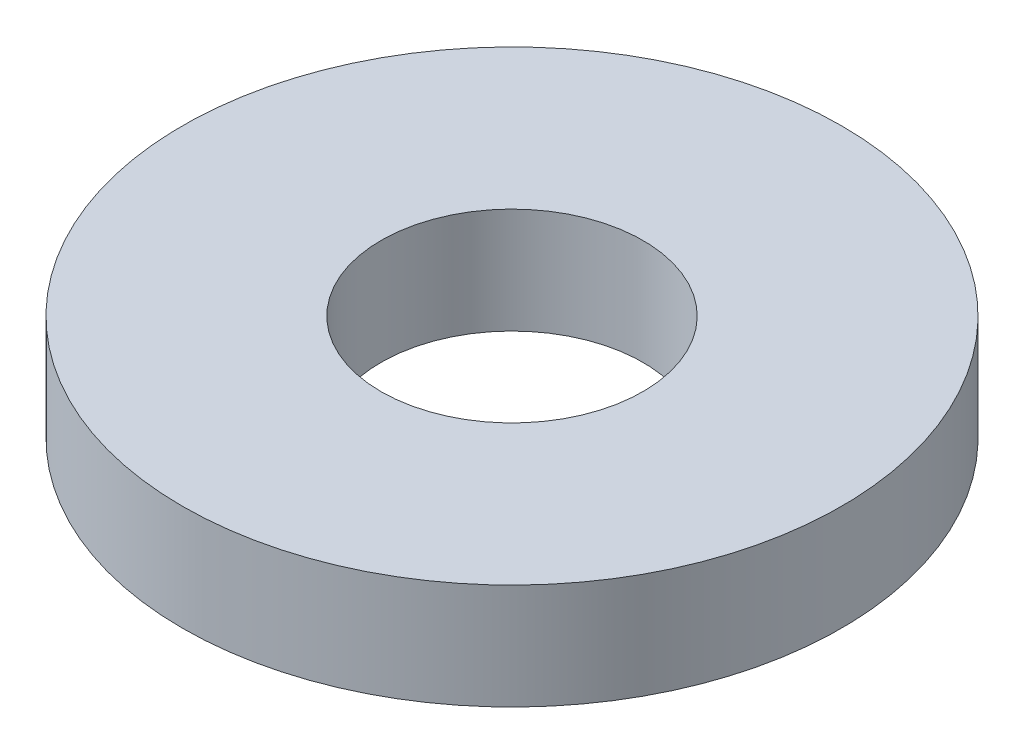
from build123d import *

# Parameters (mm, degrees)
SKETCH1_R           = 1.9812
SKETCH1_R_2         = 0.7874
BOSS_EXTRUDE1_DEPTH = 0.635


with BuildPart() as part:
    # Sketch1 → Boss-Extrude1 (new body)
    with BuildSketch(Plane(origin=(0, 0, 0), x_dir=(1, 0, 0), z_dir=(0, 1, 0))):
        with Locations(Location((0, 0, 0), (0, 0, 270))):
            Circle(SKETCH1_R)
        with Locations(Location((0, 0, 0), (0, 0, 270))):
            Circle(SKETCH1_R_2, mode=Mode.SUBTRACT)
    extrude(amount=BOSS_EXTRUDE1_DEPTH)


solid = part.part
